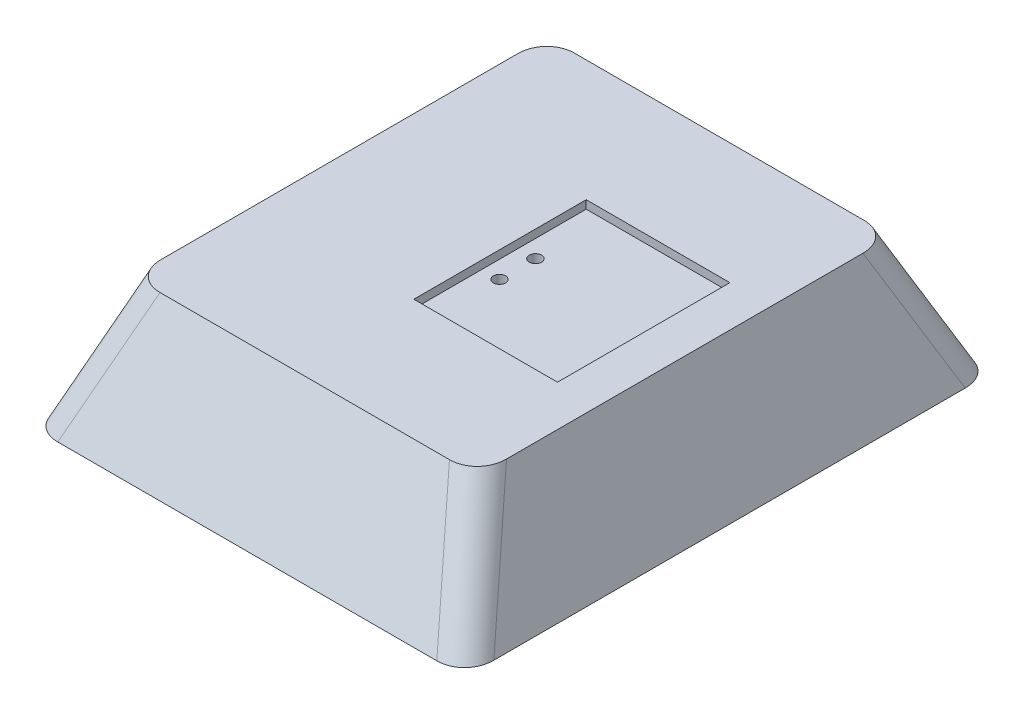
from build123d import *

# Parameters (mm, degrees)
TOP_ENCLOSURE_DEPTH    = 77
TOP_EXTRA_DEPTH        = 12
SKETCH3_W              = 35
SKETCH3_H              = 42
SOLAR_CELL_SLOT_DEPTH  = 2
SKETCH4_R              = 1.5
SOLAR_CELL_HOLES_DEPTH = 108.30330843
BOSS_EXTRUDE1_REACH    = 108.922
BOSS_EXTRUDE2_REACH    = 120.819
FILLET1_R              = 7.5


with BuildPart() as part:
    # Master_Geometry → Top_Enclosure (new body)
    with BuildSketch(Plane.XY):
        Polygon((-48, -3.5), (-53, -3.5), (-42.080892972, 26.5), (42.080892972, 26.5), (53, -3.5), (48, -3.5), (48, 4), (38, 4), (38, 21.5), (-38, 21.5), (-38, 4), (-48, 4), align=None)
    extrude(amount=TOP_ENCLOSURE_DEPTH)

    # Sketch2 → Top_Extra (add)
    with BuildSketch(Plane.XY.offset(77)):
        Polygon((-42.080892972, 26.5), (42.080892972, 26.5), (53, -3.5), (-53, -3.5), align=None)
    top_extra = extrude(amount=TOP_EXTRA_DEPTH)

    # Mirror1: Top_Extra across plane
    add(top_extra.mirror(Plane(origin=(0, 0, 38.5), x_dir=(1, 0, 0), z_dir=(0, 0, -1))))

    # Sketch3 → Solar_Cell_Slot (cut)
    with BuildSketch(Plane(origin=(0, 26.5, 0), x_dir=(1, 0, 0), z_dir=(0, 1, 0))):
        with Locations((14.580892972, -38.5)):
            Rectangle(SKETCH3_W, SKETCH3_H)
    extrude(amount=-SOLAR_CELL_SLOT_DEPTH, mode=Mode.SUBTRACT)

    # Sketch4 → Solar_Cell_Holes (cut, through all)
    with BuildSketch(Plane(origin=(0, 24.5, 0), x_dir=(1, 0, 0), z_dir=(0, 1, 0))):
        with Locations(Location((1.330892972, -34.125, 0), (0, 0, 270))):
            Circle(SKETCH4_R)
        with Locations(Location((1.330892972, -42.875, 0), (0, 0, 270))):
            Circle(SKETCH4_R)
    extrude(amount=-SOLAR_CELL_HOLES_DEPTH, mode=Mode.SUBTRACT)

    # Boss-Extrude1: up to this plane
    boss_extrude1_end = Plane(origin=(42.080892972, 26.5, 77), z_dir=(-0.9396926207859069, -0.3420201433256729, 0))
    # Sketch5 → Boss-Extrude1 (add, up to the surface)
    with BuildSketch(Plane(origin=(0, 0, 0), x_dir=(0, 0, -1), z_dir=(1, 0, 0)), mode=Mode.PRIVATE) as boss_extrude1_sk1:
        Polygon((-89, 26.5), (-89, -3.5), (-102.989229745, -3.5), align=None)
    boss_extrude1_tool1 = split(extrude(boss_extrude1_sk1.sketch, amount=BOSS_EXTRUDE1_REACH, mode=Mode.PRIVATE), bisect_by=boss_extrude1_end, keep=Keep.BOTH, mode=Mode.PRIVATE)
    boss_extrude1 = boss_extrude1_tool1.solids().sort_by_distance((0, 6.5, 93.663077))[0]
    add(boss_extrude1)

    # Boss-Extrude2: up to this face of the body (flat: up to its plane)
    boss_extrude2_end = Plane(part.part.faces().sort_by_distance((-47.540446486, 11.5, 38.5))[0])
    # Sketch6 → Boss-Extrude2 (add, up to the picked face)
    with BuildSketch(Plane.ZY, mode=Mode.PRIVATE) as boss_extrude2_sk1:
        Polygon((89, 26.5), (102.989229745, -3.5), (89, -3.5), align=None)
    boss_extrude2_tool1 = split(extrude(boss_extrude2_sk1.sketch, amount=BOSS_EXTRUDE2_REACH, mode=Mode.PRIVATE), bisect_by=boss_extrude2_end, keep=Keep.BOTH, mode=Mode.PRIVATE)
    boss_extrude2 = boss_extrude2_tool1.solids().sort_by(Axis((0, 6.5, 93.663077), (-1, 0, 0)))[0]
    add(boss_extrude2)

    # Mirror3: Boss-Extrude1, Boss-Extrude2 across plane
    add(boss_extrude1.mirror(Plane(origin=(0, 0, 38.5), x_dir=(1, 0, 0), z_dir=(0, 0, -1))))
    add(boss_extrude2.mirror(Plane(origin=(0, 0, 38.5), x_dir=(1, 0, 0), z_dir=(0, 0, -1))))

    # Fillet1
    fillet1_edges = [part.edges().sort_by_distance(p)[0] for p in [
        (-47.540446486, 11.5, 95.994614872),
        (47.540446486, 11.5, -18.994614872),
        (-47.540446486, 11.5, -18.994614872),
        (47.540446486, 11.5, 95.994614872),
    ]]
    fillet(fillet1_edges, radius=FILLET1_R)


solid = part.part
